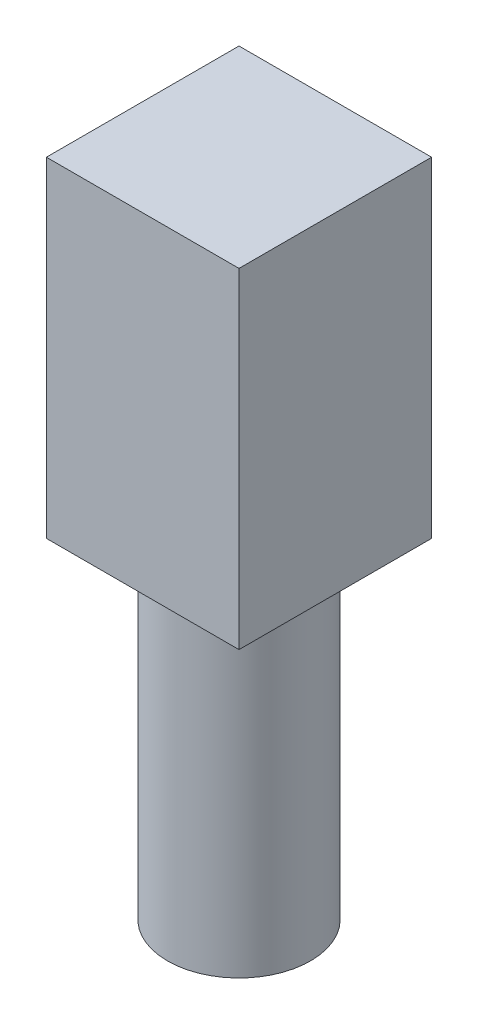
from build123d import *

# Parameters (mm, degrees)
SKETCH1_R           = 1.3
BOSS_EXTRUDE1_DEPTH = 6
SKETCH2_W           = 3.5
SKETCH2_H           = 3.5
BOSS_EXTRUDE2_DEPTH = 6


with BuildPart() as part:
    # Sketch1 → Boss-Extrude1 (new body)
    with BuildSketch(Plane(origin=(0, 0, 0), x_dir=(1, 0, 0), z_dir=(0, 1, 0))):
        with Locations(Location((0, 0, 0), (0, 0, 270))):
            Circle(SKETCH1_R)
    extrude(amount=BOSS_EXTRUDE1_DEPTH)

    # Sketch2 → Boss-Extrude2 (add)
    with BuildSketch(Plane(origin=(0, 6, 0), x_dir=(1, 0, 0), z_dir=(0, 1, 0))):
        Rectangle(SKETCH2_W, SKETCH2_H)
    extrude(amount=BOSS_EXTRUDE2_DEPTH)


solid = part.part
